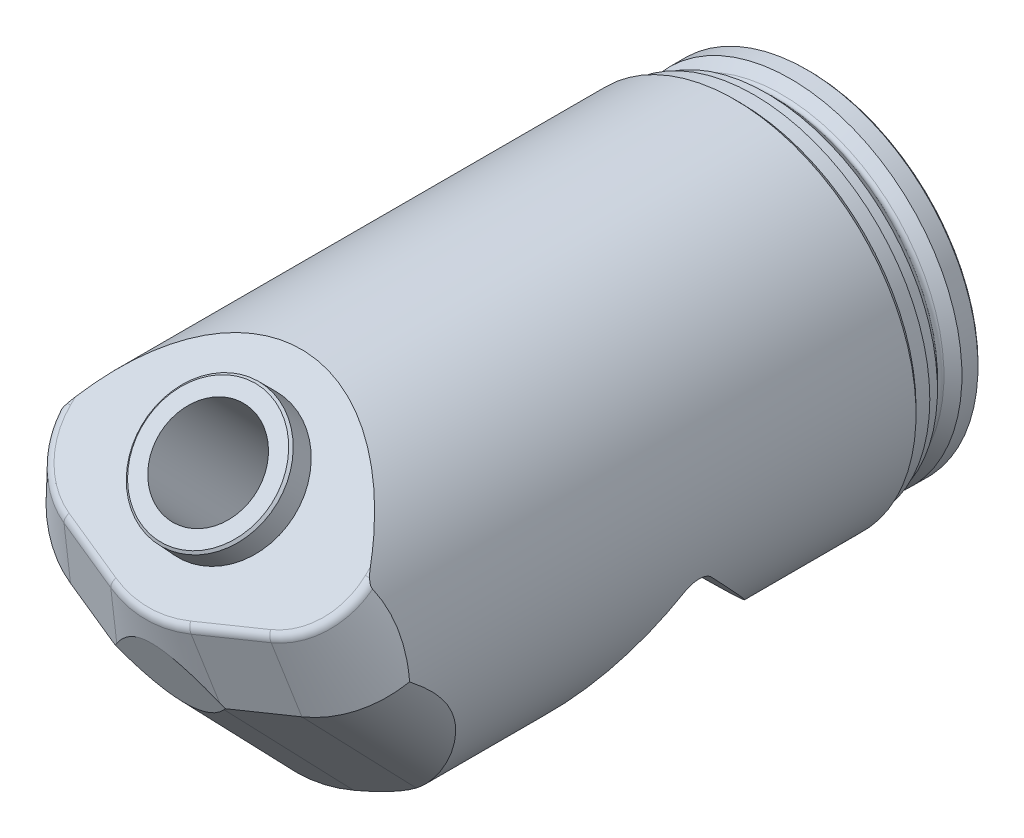
from build123d import *
from OCP.BRepFilletAPI import BRepFilletAPI_MakeChamfer

# Parameters (mm, degrees)
F_41_64_0_640630_DIAMETER_HOLE1_D = 16.272002
SKETCH7_W                         = 76.989658396
SKETCH7_H                         = 50.8
FCE_00_BOLT_HEAD_NOTCH_DEPTH      = 50.8
FILLET1_R                         = 3.175
CHAMFER1_SIZE                     = 0.381
CHAMFER1_SIZE2                    = 0.387827593
CUT_EXTRUDE1_DEPTH                = 110.652296603
CUT_EXTRUDE1_DEPTH_BACK           = 110.652296603


with BuildPart() as part:
    # Sketch3 → FBR-00 Basic blank revolve. (revolve)
    with BuildSketch(Plane(origin=(0, 0, 0), x_dir=(0, 0, -1), z_dir=(1, 0, 0)), mode=Mode.PRIVATE) as fbr_00_basic_blank_revolve_sk:
        with BuildLine():
            Line((-101.188905116, 30.1625), (-101.188905116, 0))
            Line((-101.188905116, 0), (-21.038993491, 0))
            Line((-21.038993491, 0), (-6.731, 23.8125))
            Line((-6.731, 23.8125), (9.144, 23.8125))
            Line((9.144, 23.8125), (9.144, 28.448))
            Line((9.144, 28.448), (6.096, 28.448))
            Line((6.096, 28.448), (4.602815367, 26.954815367))
            ThreePointArc((4.602815367, 26.954815367), (4.064, 26.731630735), (3.525184633, 26.954815367))
            Line((3.525184633, 26.954815367), (2.032, 28.448))
            Line((2.032, 28.448), (0, 28.448))
            Line((0, 28.448), (0, 29.21))
            Line((0, 29.21), (-2.286, 29.21))
            Line((-2.286, 29.21), (-3.2385, 30.1625))
            Line((-3.2385, 30.1625), (-101.188905116, 30.1625))
        make_face()
    revolve(fbr_00_basic_blank_revolve_sk.sketch.rotate(Axis((0, 0, -27.766671499), (0, 0, 1)), 90), axis=Axis((0, 0, -27.766671499), (0, 0, 1)))

    # Sketch13 → FCR-00 lacation boss, Cut-Revolve. (revolve, cut)
    with BuildSketch(Plane(origin=(0, 0, 0), x_dir=(0, 0, -1), z_dir=(1, 0, 0))):
        Polygon((-60.009409083, 44.720607894), (-79.306268956, 26.150824711), (-82.534005377, 29.389847768), (-90.632639597, 21.596357919), (-105.074812876, 36.603996473), (-77.621815521, 63.022606131), align=None)
    revolve(axis=Axis((0, 36.603996473, 105.074812876), (0, 0.720551111680328, 0.6934018282758155)), mode=Mode.SUBTRACT)

    # 41/64 (0.640630) Diameter Hole1 (through all)
    with Locations(Plane(origin=(0, 56.495615275, 54.366945365), x_dir=(1, 0, 0), z_dir=(0, 0.720551111680328, 0.6934018282758155))):
        with Locations((0, -50.330495151)):
            Hole(F_41_64_0_640630_DIAMETER_HOLE1_D / 2)

    # FCS-00 End trim, Cut-Sweep: sweep along a path in Sketch6
    with BuildLine(Plane(origin=(0, 53.201255592, 51.196712206), x_dir=(1, 0, 0), z_dir=(0, 0.720551111680328, 0.6934018282758155))) as fcs_00_end_trim_cut_sweep_path:
        Line((-25.4, -39.765602031), (-25.4, -52.465602031))
        ThreePointArc((-25.4, -52.465602031), (-23.103230962, -59.750022773), (-17.04365582, -64.399698315))
        Line((-17.04365582, -64.399698315), (-6.51548373, -68.231639577))
        ThreePointArc((-6.51548373, -68.231639577), (-3.307997785, -69.091082846), (0, -69.380495151))
    # Sketch16 → FCS-00 End trim, Cut-Sweep (sweep, cut)
    with BuildSketch(Plane(origin=(0, 117.771567215, -110.982310617), x_dir=(0, -0.9982398279237649, -0.059306373575968775), z_dir=(-1, 0, 0))):
        with BuildLine():
            Line((152.30720814, 182.06896008), (168.803188567, 201.383271607))
            Line((168.803188567, 201.383271607), (110.860253989, 250.871212889))
            Line((110.860253989, 250.871212889), (88.178280901, 224.314034541))
            Line((88.178280901, 224.314034541), (97.835436664, 216.066044327))
            Line((97.835436664, 216.066044327), (99.302186796, 217.783388083))
            ThreePointArc((99.302186796, 217.783388083), (99.979412877, 218.248832673), (100.798630163, 218.313306472))
            Line((100.798630163, 218.313306472), (112.384771543, 216.165942094))
            Line((112.384771543, 216.165942094), (152.30720814, 182.06896008))
        make_face()
    fcs_00_end_trim_cut_sweep = sweep(path=fcs_00_end_trim_cut_sweep_path.line, mode=Mode.SUBTRACT)

    # FMR-00 Mirror end trim.: FCS-00 End trim, Cut-Sweep across plane
    add(fcs_00_end_trim_cut_sweep.mirror(Plane(origin=(0, 0, 0), x_dir=(0, 0, 1), z_dir=(1, 0, 0))), mode=Mode.SUBTRACT)

    # Sketch7 → FCE-00 Bolt head notch. (cut)
    with BuildSketch(Plane(origin=(0, -18.301998237, 52.237593562), x_dir=(1, 0, 0), z_dir=(0, -0.7205511116803286, -0.6934018282758149))):
        with Locations((0, 6.35)):
            Rectangle(SKETCH7_W, SKETCH7_H)
    extrude(amount=FCE_00_BOLT_HEAD_NOTCH_DEPTH, mode=Mode.SUBTRACT)

    # Fillet1
    fillet1_edges = [part.edges().sort_by_distance(p)[0] for p in [
        (0, -5.092693408, 38.511094884),
    ]]
    fillet(fillet1_edges, radius=FILLET1_R)

    # Chamfer1: one chamfer whose edges measure the first distance from different faces: ONE call of the kernel's chamfer builder (chamfer() names one face for all edges)
    chamfer1_edges_1 = [part.edges().sort_by_distance(p)[0] for p in [
        (28.448, 0, -9.144),
        (23.8125, 0, -9.144),
    ]]
    chamfer1_edges_2 = [part.edges().sort_by_distance(p)[0] for p in [
        (0, 13.80286807, 98.731273817),
    ]]
    chamfer1_side_2 = [part.faces().sort_by_distance(p)[0] for p in [
        (0, 14.023301251, 98.50220985),
    ]]
    chamfer1 = BRepFilletAPI_MakeChamfer(part.part.solid().wrapped)
    for e in chamfer1_edges_1:
        chamfer1.Add(CHAMFER1_SIZE, e.wrapped)
    for e in chamfer1_edges_2:
        chamfer1.Add(CHAMFER1_SIZE, CHAMFER1_SIZE2, e.wrapped, chamfer1_side_2[0].wrapped)  # the first distance lies on this face
    add(Compound.cast(chamfer1.Shape()), mode=Mode.REPLACE)

    # Sketch17 → Cut-Extrude1 (cut, two sides: drawn at the far end of the back side and taken through both)
    with BuildSketch(Plane(origin=(0, 0, 0), x_dir=(0, 0, -1), z_dir=(1, 0, 0)).offset(-CUT_EXTRUDE1_DEPTH_BACK)):
        Polygon((-220.872013196, 249.233244147), (-107.294691274, 15.329981457), (-88.096461038, -24.20721324), (25.480860884, -258.110475929), (-442.325664495, -485.265119773), (-688.678538575, 22.078600303), align=None)
    extrude(amount=CUT_EXTRUDE1_DEPTH + CUT_EXTRUDE1_DEPTH_BACK, mode=Mode.SUBTRACT)


solid = part.part
